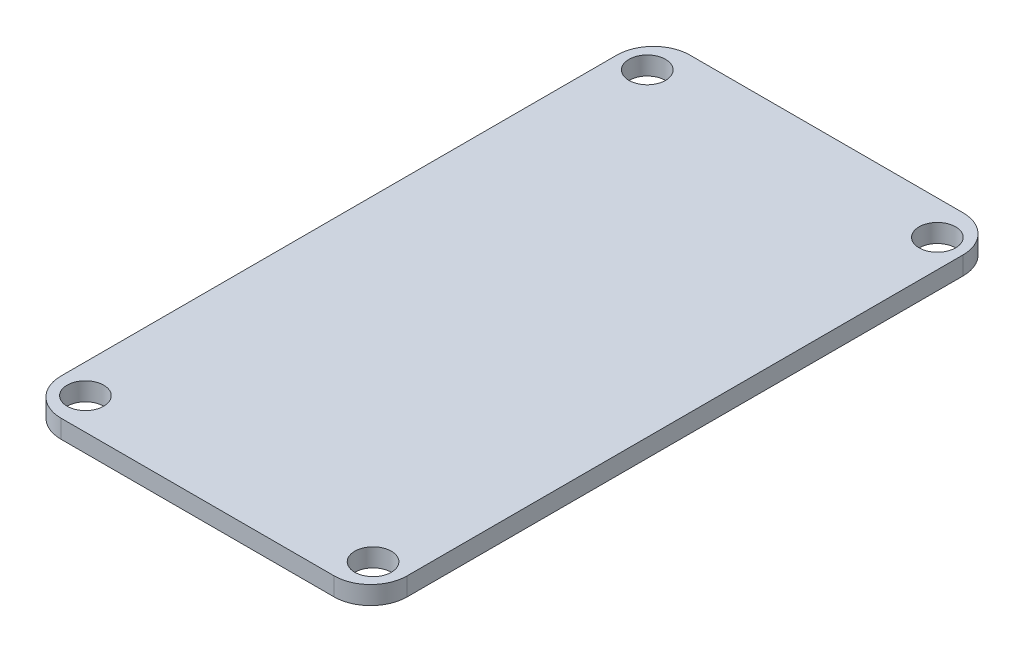
from build123d import *

# Parameters (mm, degrees)
BOSS_EXTRUDE1_DEPTH = 0.75
CUT_EXTRUDE1_REACH  = 31.488
SKETCH3_R           = 1.5


with BuildPart() as part:
    # Sketch1 → Boss-Extrude1 (new, symmetric)
    with BuildSketch(Plane(origin=(0, 0, 0), x_dir=(1, 0, 0), z_dir=(0, 1, 0))):
        with BuildLine():
            Line((-11.2, 25.8), (11.2, 25.8))
            ThreePointArc((11.2, 25.8), (13.321320344, 24.921320344), (14.2, 22.8))
            Line((14.2, 22.8), (14.2, -22.8))
            ThreePointArc((14.2, -22.8), (13.321320344, -24.921320344), (11.2, -25.8))
            Line((11.2, -25.8), (-11.2, -25.8))
            ThreePointArc((-11.2, -25.8), (-13.321320344, -24.921320344), (-14.2, -22.8))
            Line((-14.2, -22.8), (-14.2, 22.8))
            ThreePointArc((-14.2, 22.8), (-13.321320344, 24.921320344), (-11.2, 25.8))
        make_face()
    extrude(amount=BOSS_EXTRUDE1_DEPTH, both=True)

    # Sketch3 → Cut-Extrude1 (cut, up to next)
    with BuildSketch(Plane(origin=(0, 0.75, 0), x_dir=(1, 0, 0), z_dir=(0, 1, 0)), mode=Mode.PRIVATE) as cut_extrude1_sk1:
        with Locations(Location((11.9, 23, 0), (0, 0, 270))):
            Circle(SKETCH3_R)
    cut_extrude1_tool1 = extrude(cut_extrude1_sk1.sketch, amount=-CUT_EXTRUDE1_REACH, mode=Mode.PRIVATE) & part.part
    # Sketch3 → Cut-Extrude1 (cut, up to next)
    with BuildSketch(Plane(origin=(0, 0.75, 0), x_dir=(1, 0, 0), z_dir=(0, 1, 0)), mode=Mode.PRIVATE) as cut_extrude1_sk2:
        with Locations(Location((-11.9, 23, 0), (0, 0, 270))):
            Circle(SKETCH3_R)
    cut_extrude1_tool2 = extrude(cut_extrude1_sk2.sketch, amount=-CUT_EXTRUDE1_REACH, mode=Mode.PRIVATE) & part.part
    # Sketch3 → Cut-Extrude1 (cut, up to next)
    with BuildSketch(Plane(origin=(0, 0.75, 0), x_dir=(1, 0, 0), z_dir=(0, 1, 0)), mode=Mode.PRIVATE) as cut_extrude1_sk3:
        with Locations(Location((11.8, -23.2, 0), (0, 0, 270))):
            Circle(SKETCH3_R)
    cut_extrude1_tool3 = extrude(cut_extrude1_sk3.sketch, amount=-CUT_EXTRUDE1_REACH, mode=Mode.PRIVATE) & part.part
    # Sketch3 → Cut-Extrude1 (cut, up to next)
    with BuildSketch(Plane(origin=(0, 0.75, 0), x_dir=(1, 0, 0), z_dir=(0, 1, 0)), mode=Mode.PRIVATE) as cut_extrude1_sk4:
        with Locations(Location((-11.8, -23.2, 0), (0, 0, 270))):
            Circle(SKETCH3_R)
    cut_extrude1_tool4 = extrude(cut_extrude1_sk4.sketch, amount=-CUT_EXTRUDE1_REACH, mode=Mode.PRIVATE) & part.part
    add(cut_extrude1_tool1.solids().sort_by_distance((11.9, 0.75, -23))[0], mode=Mode.SUBTRACT)
    add(cut_extrude1_tool2.solids().sort_by_distance((-11.9, 0.75, -23))[0], mode=Mode.SUBTRACT)
    add(cut_extrude1_tool3.solids().sort_by_distance((11.8, 0.75, 23.2))[0], mode=Mode.SUBTRACT)
    add(cut_extrude1_tool4.solids().sort_by_distance((-11.8, 0.75, 23.2))[0], mode=Mode.SUBTRACT)


solid = part.part
